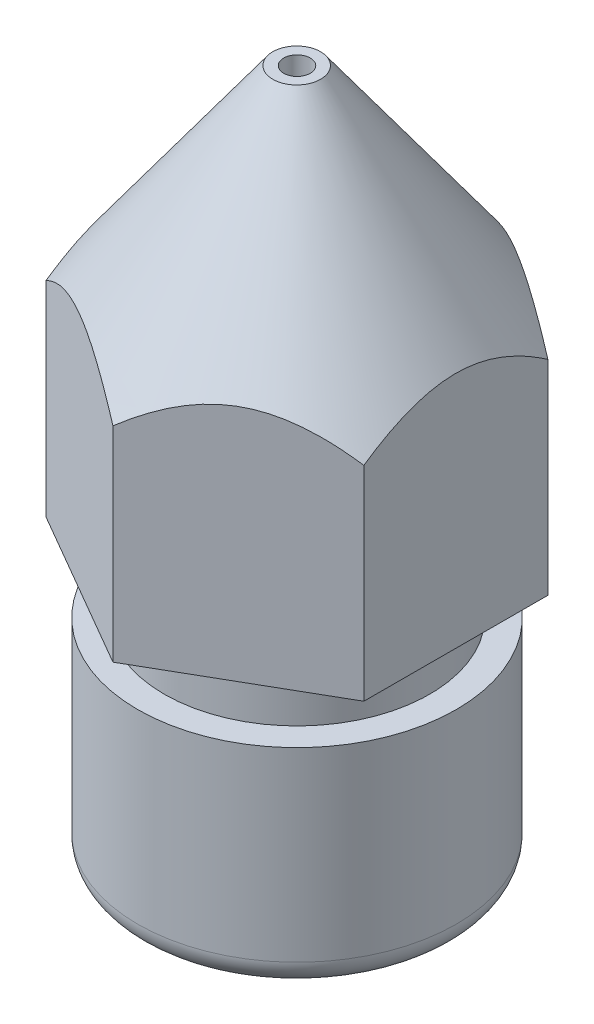
from build123d import *

# Parameters (mm, degrees)
BOSS_EXTRUDE1_DEPTH = 8
SKETCH3_R           = 2.5
BOSS_EXTRUDE2_DEPTH = 1
SKETCH4_R           = 3
BOSS_EXTRUDE3_DEPTH = 4
FILLET1_R           = 0.5
SKETCH5_R           = 0.25
CUT_EXTRUDE1_DEPTH  = 100
CHAMFER1_SIZE       = 1
CHAMFER1_SIZE2      = 4.331475874
CHAMFER2_SIZE       = 0.25
CHAMFER2_SIZE2      = 0.333591751


with BuildPart() as part:
    # Sketch1 → Boss-Extrude1 (new body)
    with BuildSketch(Plane(origin=(0, 0, 0), x_dir=(1, 0, 0), z_dir=(0, 1, 0))):
        Polygon((-2.999284009, -1.725078384), (-0.0056803, -3.459995337), (2.993603709, -1.734916953), (2.999284009, 1.725078384), (0.0056803, 3.459995337), (-2.993603709, 1.734916953), align=None)
    extrude(amount=BOSS_EXTRUDE1_DEPTH)

    # Sketch2 → Cut-Revolve2 (revolve, cut)
    with BuildSketch(Plane.XY, mode=Mode.PRIVATE) as cut_revolve2_sk:
        Polygon((-0.4556803, 8), (-4.194310439, 2.85), (-4.194310439, 8), align=None)
    revolve(cut_revolve2_sk.sketch.rotate(Axis((-0.0056803, 8, 0), (0, -1, 0)), 90.188125981), axis=Axis((-0.0056803, 8, 0), (0, -1, 0)), mode=Mode.SUBTRACT)

    # Sketch3 → Boss-Extrude2 (add)
    with BuildSketch(Plane.XZ):
        with Locations(Location((0, 0, 0), (0, 0, 270))):
            Circle(SKETCH3_R)
    extrude(amount=BOSS_EXTRUDE2_DEPTH)

    # Sketch4 → Boss-Extrude3 (add)
    with BuildSketch(Plane.XZ.offset(1)):
        with Locations(Location((0, 0, 0), (0, 0, 270))):
            Circle(SKETCH4_R)
    extrude(amount=BOSS_EXTRUDE3_DEPTH)

    # Fillet1
    fillet1_edges = [part.edges().sort_by_distance(p)[0] for p in [
        (0, -5, 3),
    ]]
    fillet(fillet1_edges, radius=FILLET1_R)

    # Sketch5 → Cut-Extrude1 (cut)
    with BuildSketch(Plane(origin=(0, 8, 0), x_dir=(1, 0, 0), z_dir=(0, 1, 0))):
        with Locations(Location((0, 0, 0), (0, 0, 270))):
            Circle(SKETCH5_R)
    extrude(amount=-CUT_EXTRUDE1_DEPTH, mode=Mode.SUBTRACT)

    # Chamfer1
    chamfer1_edges = [part.edges().sort_by_distance(p)[0] for p in [
        (0, -5, -0.25),
    ]]
    chamfer1_side = [part.faces().sort_by_distance(p)[0] for p in [
        (0, -5, 2.429289322),
    ]]
    chamfer(chamfer1_edges, length=CHAMFER1_SIZE, length2=CHAMFER1_SIZE2, reference=chamfer1_side[0])

    # Chamfer2
    chamfer2_edges = [part.edges().sort_by_distance(p)[0] for p in [
        (0, -5, -1.25),
    ]]
    chamfer2_side = [part.faces().sort_by_distance(p)[0] for p in [
        (0, -2.834262063, -0.75),
    ]]
    chamfer(chamfer2_edges, length=CHAMFER2_SIZE, length2=CHAMFER2_SIZE2, reference=chamfer2_side[0])


solid = part.part
